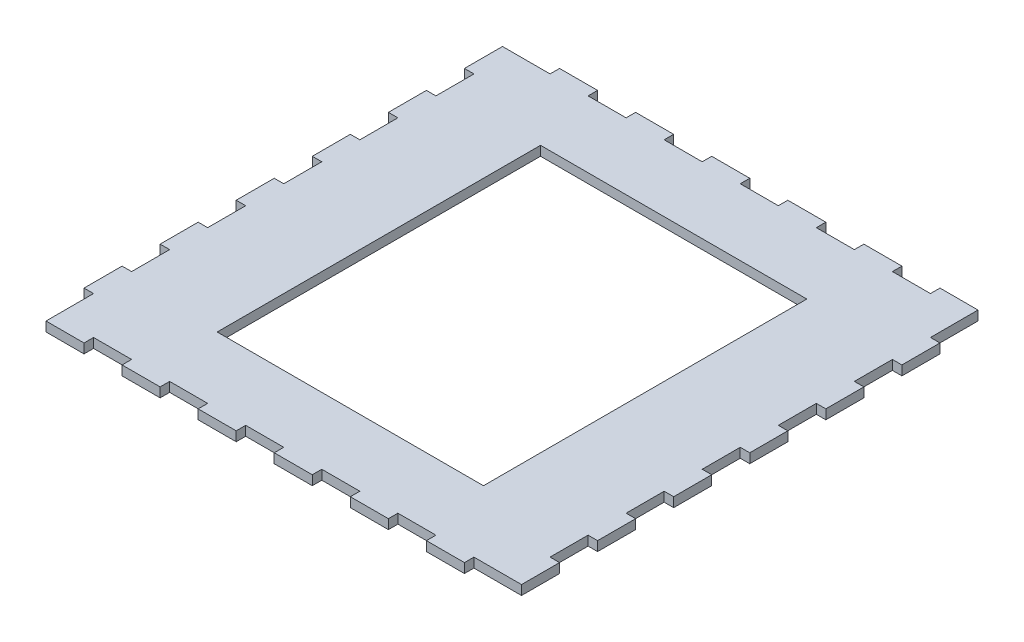
from build123d import *

# Parameters (mm, degrees)
BOSS_EXTRUDE1_DEPTH = 6.35
SKETCH2_W           = 177.8
SKETCH2_H           = 215.9
CUT_EXTRUDE2_DEPTH  = 6.35


with BuildPart() as part:
    # Sketch1 → Boss-Extrude1 (new body)
    with BuildSketch(Plane(origin=(0, 0, 0), x_dir=(1, 0, 0), z_dir=(0, 1, 0))):
        Polygon((-65.292450766, -101.6), (-39.892450766, -101.6), (-39.892450766, -107.95), (-14.492450766, -107.95), (-14.492450766, -101.6), (10.907549234, -101.6), (10.907549234, -107.95), (36.307549234, -107.95), (36.307549234, -101.6), (61.707549234, -101.6), (61.707549234, -107.95), (87.107549234, -107.95), (87.107549234, -101.6), (112.507549234, -101.6), (112.507549234, -107.95), (137.907549234, -107.95), (137.907549234, -101.6), (163.307549234, -101.6), (163.307549234, -107.95), (188.707549234, -107.95), (188.707549234, -101.6), (220.457549234, -101.6), (220.457549234, -76.2), (214.107549234, -76.2), (214.107549234, -50.8), (220.457549234, -50.8), (220.457549234, -25.4), (214.107549234, -25.4), (214.107549234, 0), (220.457549234, 0), (220.457549234, 25.4), (214.107549234, 25.4), (214.107549234, 50.8), (220.457549234, 50.8), (220.457549234, 76.2), (214.107549234, 76.2), (214.107549234, 101.6), (220.457549234, 101.6), (220.457549234, 127), (214.107549234, 127), (214.107549234, 152.4), (220.457549234, 152.4), (220.457549234, 177.8), (214.107549234, 177.8), (214.107549234, 209.55), (188.707549234, 209.55), (188.707549234, 203.2), (163.307549234, 203.2), (163.307549234, 209.55), (137.907549234, 209.55), (137.907549234, 203.2), (112.507549234, 203.2), (112.507549234, 209.55), (87.107549234, 209.55), (87.107549234, 203.2), (61.707549234, 203.2), (61.707549234, 209.55), (36.307549234, 209.55), (36.307549234, 203.2), (10.907549234, 203.2), (10.907549234, 209.55), (-14.492450766, 209.55), (-14.492450766, 203.2), (-39.892450766, 203.2), (-39.892450766, 209.55), (-65.292450766, 209.55), (-65.292450766, 203.2), (-97.042450766, 203.2), (-97.042450766, 177.8), (-90.692450766, 177.8), (-90.692450766, 152.4), (-97.042450766, 152.4), (-97.042450766, 127), (-90.692450766, 127), (-90.692450766, 101.6), (-97.042450766, 101.6), (-97.042450766, 76.2), (-90.692450766, 76.2), (-90.692450766, 50.8), (-97.042450766, 50.8), (-97.042450766, 25.4), (-90.692450766, 25.4), (-90.692450766, 0), (-97.042450766, 0), (-97.042450766, -25.4), (-90.692450766, -25.4), (-90.692450766, -50.8), (-97.042450766, -50.8), (-97.042450766, -76.2), (-90.692450766, -76.2), (-90.692450766, -107.95), (-65.292450766, -107.95), align=None)
    extrude(amount=BOSS_EXTRUDE1_DEPTH)

    # Sketch2 → Cut-Extrude2 (cut)
    with BuildSketch(Plane(origin=(0, 6.35, 0), x_dir=(1, 0, 0), z_dir=(0, 1, 0))):
        with Locations((61.707549234, 50.8)):
            Rectangle(SKETCH2_W, SKETCH2_H)
    extrude(amount=-CUT_EXTRUDE2_DEPTH, mode=Mode.SUBTRACT)


solid = part.part
